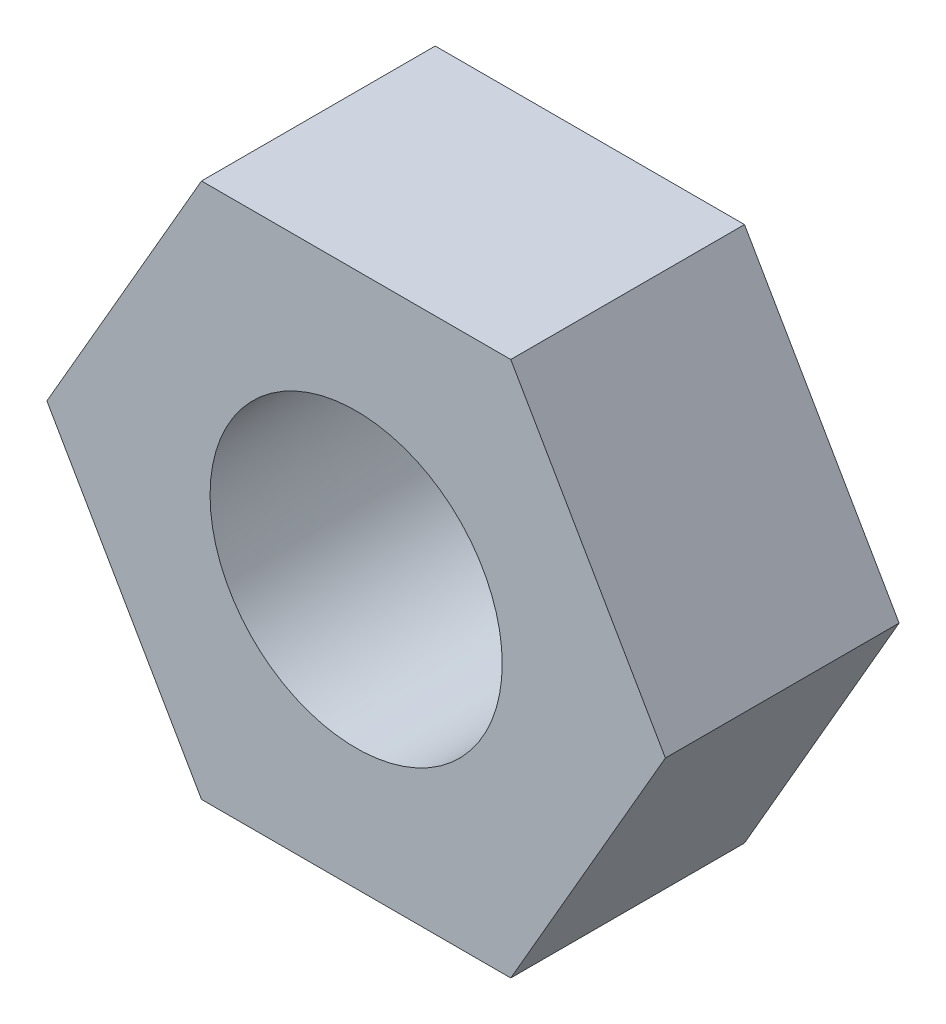
from build123d import *

# Parameters (mm, degrees)
SKETCH_1_R      = 1.5
EXTRUDE_1_DEPTH = 2.4


with BuildPart() as part:
    # 草图1 → 凸台-拉伸1 (new body)
    with BuildSketch(Plane.XY):
        Polygon((-1.58771324, 2.75), (-3.175426481, 0), (-1.58771324, -2.75), (1.58771324, -2.75), (3.175426481, 0), (1.58771324, 2.75), align=None)
        Circle(SKETCH_1_R, mode=Mode.SUBTRACT)
    extrude(amount=EXTRUDE_1_DEPTH)


solid = part.part
